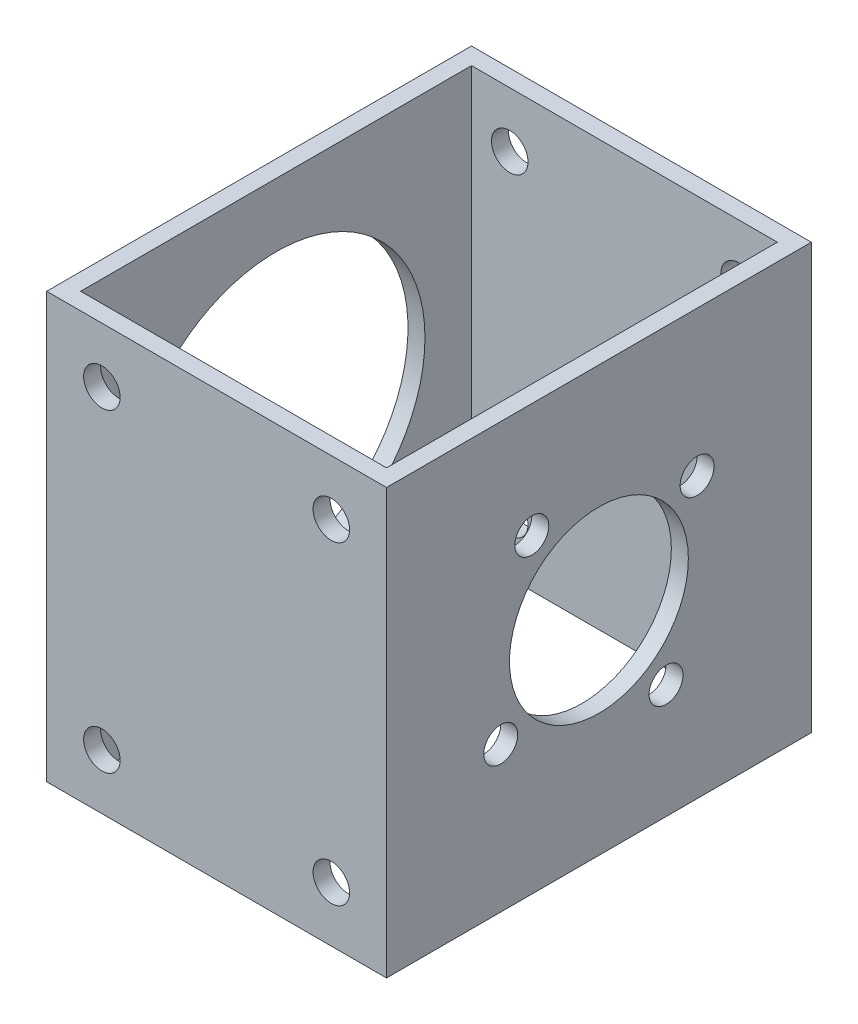
from build123d import *

# Parameters (mm, degrees)
SKETCH_1_W          = 40
SKETCH_1_H          = 50
SKETCH_1_W_2        = 36
SKETCH_1_H_2        = 46
EXTRUDE_1_DEPTH     = 50
SKETCH_2_R          = 2.15
CUT_EXTRUDE_1_DEPTH = 82.240384046
CUT_EXTRUDE_2_REACH = 83.24
SKETCH_3_R          = 17.525
CUT_EXTRUDE_3_REACH = 83.24
SKETCH_4_R          = 10.525
SKETCH_5_R          = 2
CUT_EXTRUDE_5_DEPTH = 10


with BuildPart() as part:
    # 草图1 → 凸台-拉伸1 (new body)
    with BuildSketch(Plane(origin=(0, 0, 0), x_dir=(1, 0, 0), z_dir=(0, 1, 0))):
        with Locations((20, -25)):
            Rectangle(SKETCH_1_W, SKETCH_1_H)
        with Locations((20, -25)):
            Rectangle(SKETCH_1_W_2, SKETCH_1_H_2, mode=Mode.SUBTRACT)
    extrude(amount=EXTRUDE_1_DEPTH)

    # 草图2 → 切除-拉伸1 (cut, through all)
    with BuildSketch(Plane(origin=(0, 0, 0), x_dir=(-1, 0, 0), z_dir=(0, 0, -1))):
        with Locations((-6.5, 6.5)):
            Circle(SKETCH_2_R)
        with Locations((-33.5, 6.5)):
            Circle(SKETCH_2_R)
        with Locations((-33.5, 43.5)):
            Circle(SKETCH_2_R)
        with Locations((-6.5, 43.5)):
            Circle(SKETCH_2_R)
    extrude(amount=-CUT_EXTRUDE_1_DEPTH, mode=Mode.SUBTRACT)

    # 草图3 → Cut-Extrude 2 (cut, up to next)
    with BuildSketch(Plane.ZY, mode=Mode.PRIVATE) as cut_extrude_2_sk1:
        with Locations((25, 25)):
            Circle(SKETCH_3_R)
    cut_extrude_2_tool1 = extrude(cut_extrude_2_sk1.sketch, amount=-CUT_EXTRUDE_2_REACH, mode=Mode.PRIVATE) & part.part
    add(cut_extrude_2_tool1.solids().sort_by_distance((0, 25, 25))[0], mode=Mode.SUBTRACT)

    # 草图4 → Cut-Extrude 3 (cut, up to next)
    with BuildSketch(Plane(origin=(40, 0, 0), x_dir=(0, 0, -1), z_dir=(1, 0, 0)), mode=Mode.PRIVATE) as cut_extrude_3_sk1:
        with Locations((-25, 25)):
            Circle(SKETCH_4_R)
    cut_extrude_3_tool1 = extrude(cut_extrude_3_sk1.sketch, amount=-CUT_EXTRUDE_3_REACH, mode=Mode.PRIVATE) & part.part
    add(cut_extrude_3_tool1.solids().sort_by_distance((40, 25, 25))[0], mode=Mode.SUBTRACT)

    # 草图5 → Cut-Extrude 5 (cut)
    with BuildSketch(Plane(origin=(40, 0, 0), x_dir=(0, 0, -1), z_dir=(1, 0, 0))):
        with Locations((-17.1, 13.441885967)):
            Circle(SKETCH_5_R)
        with Locations((-36.558114033, 17.1)):
            Circle(SKETCH_5_R)
        with Locations((-32.9, 36.558114033)):
            Circle(SKETCH_5_R)
        with Locations((-13.441885967, 32.9)):
            Circle(SKETCH_5_R)
    extrude(amount=-CUT_EXTRUDE_5_DEPTH, mode=Mode.SUBTRACT)


solid = part.part
